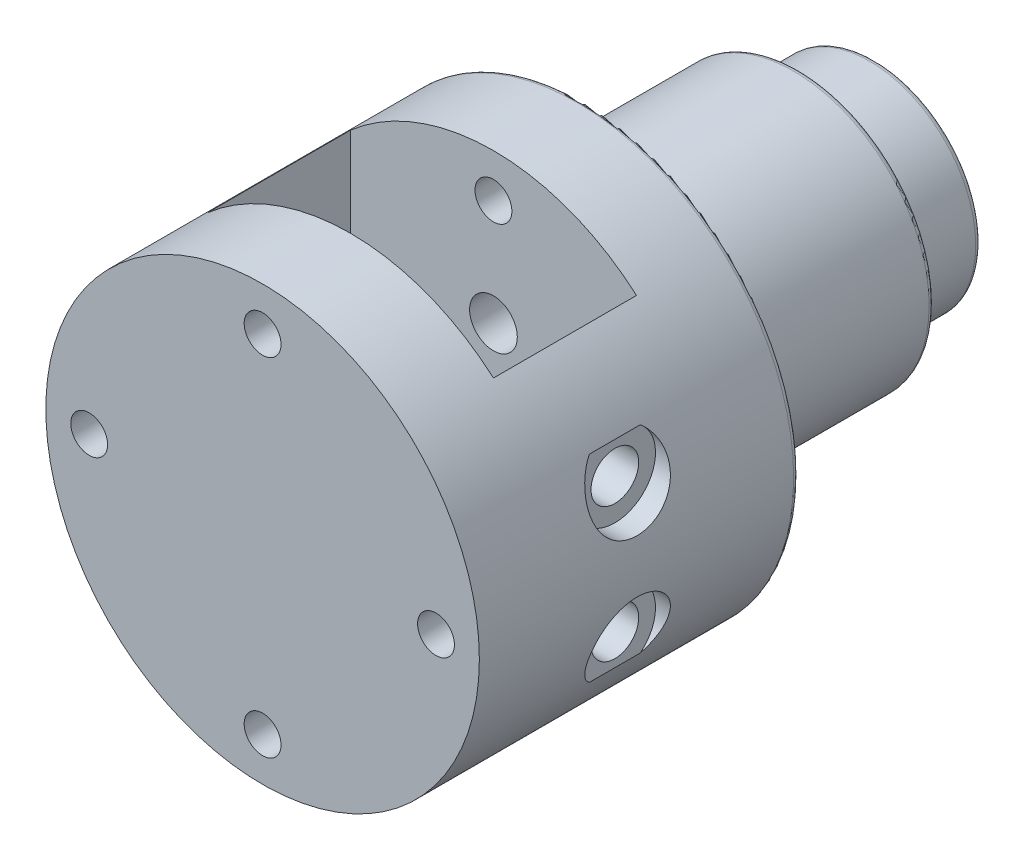
from build123d import *

# Parameters (mm, degrees)
SKETCH_1_R               = 20
EXTRUDE_1_DEPTH          = 29.5
CUT_EXTRUDE_1_DEPTH      = 30
CUT_EXTRUDE_1_DEPTH_BACK = 30
SKETCH_2_W               = 26.4
SKETCH_2_H               = 13.2
SKETCH_4_R               = 1.7
CUT_EXTRUDE_3_DEPTH      = 41.868692174
SKETCH_5_R               = 12.5
EXTRUDE_2_DEPTH          = 20
SKETCH_6_R               = 9.8
EXTRUDE_3_DEPTH          = 7
CUT_EXTRUDE_7_REACH      = 65.184
SKETCH_7_R               = 2.2
CUT_EXTRUDE_8_DEPTH      = 49.70821286
CUT_EXTRUDE_8_DEPTH_BACK = 49.70821286
SKETCH_8_R               = 2.2
CUT_EXTRUDE_START        = -5
SKETCH_9_R               = 3.75
CUT_EXTRUDE_9_DEPTH      = 10
CUT_EXTRUDE_START_2      = 41
SKETCH_10_R              = 3.75
CUT_EXTRUDE_10_DEPTH     = 10
FILLET_1_R               = 0.5
FILLET_2_R               = 1


with BuildPart() as part:
    # 草图1 → 凸台-拉伸1 (new body)
    with BuildSketch(Plane.XY):
        Circle(SKETCH_1_R)
    extrude(amount=EXTRUDE_1_DEPTH)

    # 草图2 → 切除-拉伸1 (cut, two sides: drawn at the far end of the back side and taken through both)
    with BuildSketch(Plane(origin=(0, 0, 0), x_dir=(1, 0, 0), z_dir=(0, 1, 0)).offset(-CUT_EXTRUDE_1_DEPTH_BACK)):
        with Locations((0, -14.8)):
            Rectangle(SKETCH_2_W, SKETCH_2_H)
    extrude(amount=CUT_EXTRUDE_1_DEPTH + CUT_EXTRUDE_1_DEPTH_BACK, mode=Mode.SUBTRACT)

    # 草图4 → 切除-拉伸3 (cut, through all)
    with BuildSketch(Plane(origin=(0, 0, 0), x_dir=(-1, 0, 0), z_dir=(0, 0, -1))):
        with Locations((0, 16)):
            Circle(SKETCH_4_R)
        with Locations((16, 0)):
            Circle(SKETCH_4_R)
        with Locations((0, -16)):
            Circle(SKETCH_4_R)
        with Locations((-16, 0)):
            Circle(SKETCH_4_R)
    extrude(amount=-CUT_EXTRUDE_3_DEPTH, mode=Mode.SUBTRACT)

    # 草图5 → 凸台-拉伸2 (add)
    with BuildSketch(Plane(origin=(0, 0, 0), x_dir=(-1, 0, 0), z_dir=(0, 0, -1))):
        Circle(SKETCH_5_R)
    extrude(amount=EXTRUDE_2_DEPTH)

    # 草图6 → 凸台-拉伸3 (add)
    with BuildSketch(Plane(origin=(0, 0, -20), x_dir=(-1, 0, 0), z_dir=(0, 0, -1))):
        Circle(SKETCH_6_R)
    extrude(amount=EXTRUDE_3_DEPTH)

    # 草图7 → 切除-拉伸7 (cut, up to next)
    with BuildSketch(Plane(origin=(0, 0, -27), x_dir=(-1, 0, 0), z_dir=(0, 0, -1)), mode=Mode.PRIVATE) as cut_extrude_7_sk1:
        with Locations((0, 6.2)):
            Circle(SKETCH_7_R)
    cut_extrude_7_tool1 = extrude(cut_extrude_7_sk1.sketch, amount=-CUT_EXTRUDE_7_REACH, mode=Mode.PRIVATE) & part.part
    # 草图7 → 切除-拉伸7 (cut, up to next)
    with BuildSketch(Plane(origin=(0, 0, -27), x_dir=(-1, 0, 0), z_dir=(0, 0, -1)), mode=Mode.PRIVATE) as cut_extrude_7_sk2:
        with Locations((0, -6.2)):
            Circle(SKETCH_7_R)
    cut_extrude_7_tool2 = extrude(cut_extrude_7_sk2.sketch, amount=-CUT_EXTRUDE_7_REACH, mode=Mode.PRIVATE) & part.part
    add(cut_extrude_7_tool1.solids().sort_by_distance((0, 6.2, -27))[0], mode=Mode.SUBTRACT)
    add(cut_extrude_7_tool2.solids().sort_by_distance((0, -6.2, -27))[0], mode=Mode.SUBTRACT)

    # 草图8 → 切除-拉伸8 (cut, two sides: drawn at the far end of the back side and taken through both)
    with BuildSketch(Plane(origin=(-13.2, 0, 0), x_dir=(0, 0, -1), z_dir=(1, 0, 0)).offset(-CUT_EXTRUDE_8_DEPTH_BACK)):
        with Locations((-14.8, 6.2)):
            Circle(SKETCH_8_R)
        with Locations((-14.8, -6.2)):
            Circle(SKETCH_8_R)
    extrude(amount=CUT_EXTRUDE_8_DEPTH + CUT_EXTRUDE_8_DEPTH_BACK, mode=Mode.SUBTRACT)

    # 草图9 → 切除-拉伸9 (cut)
    with BuildSketch(Plane(origin=(-13.2, 0, 0), x_dir=(0, 0, -1), z_dir=(1, 0, 0)).offset(CUT_EXTRUDE_START)):
        with Locations((-14.8, 6.2)):
            Circle(SKETCH_9_R)
        with Locations((-14.8, -6.2)):
            Circle(SKETCH_9_R)
    extrude(amount=-CUT_EXTRUDE_9_DEPTH, mode=Mode.SUBTRACT)

    # 草图10 → 切除-拉伸10 (cut)
    with BuildSketch(Plane(origin=(-13.2, 0, 0), x_dir=(0, 0, -1), z_dir=(1, 0, 0)).offset(CUT_EXTRUDE_START_2)):
        with Locations((-14.8, 6.2)):
            Circle(SKETCH_10_R)
        with Locations((-14.8, -6.2)):
            Circle(SKETCH_10_R)
    extrude(amount=-CUT_EXTRUDE_10_DEPTH, mode=Mode.SUBTRACT)

    # 圆角1
    fillet_1_edges = [part.edges().sort_by_distance(p)[0] for p in [
        (9.8, 0, -27),
        (12.5, 0, -20),
        (-20, 0, 0),
    ]]
    fillet(fillet_1_edges, radius=FILLET_1_R)

    # 圆角2
    fillet_2_edges = [part.edges().sort_by_distance(p)[0] for p in [
        (12.5, 0, 0),
    ]]
    fillet(fillet_2_edges, radius=FILLET_2_R)


solid = part.part
